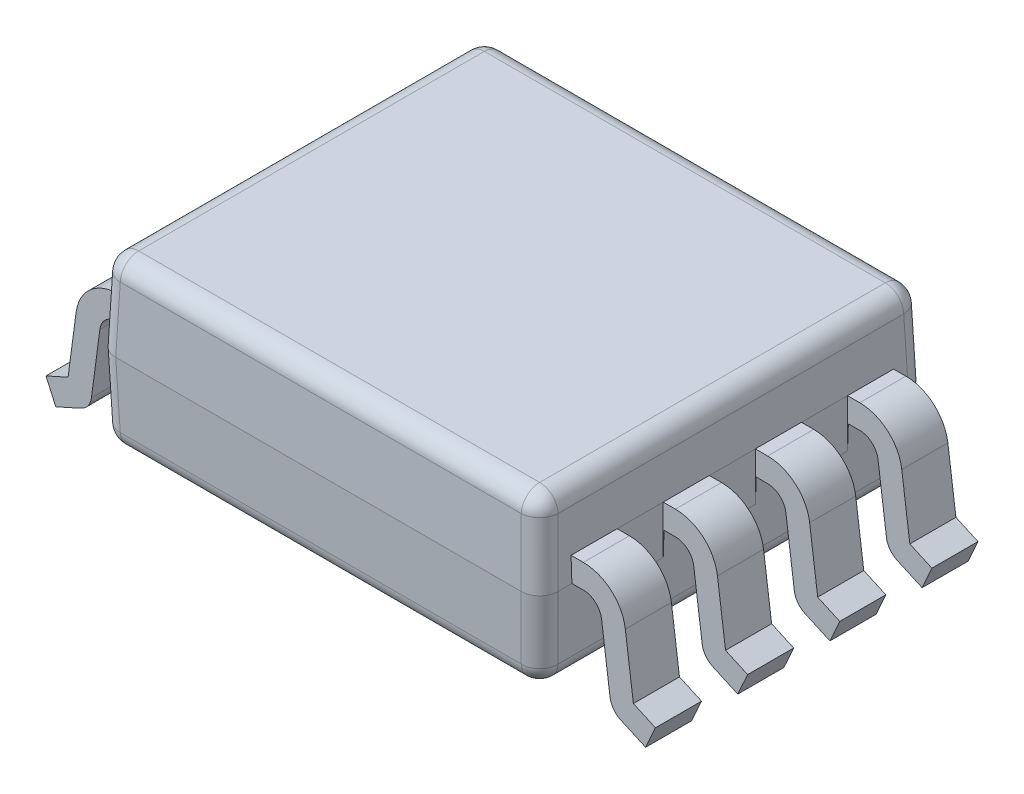
from build123d import *

# Parameters (mm, degrees)
SKETCH_1_W                = 2.4
SKETCH_1_H                = 2.1
EXTRUDE_1_DEPTH           = 0.45
EXTRUDE_1_TAPER           = 2
EXTRUDE_1_OTHER_WAY_DEPTH = 0.45
EXTRUDE_1_OTHER_WAY_TAPER = 2
EXTRUDE_2_DEPTH           = 0.875
EXTRUDE_2_DEPTH_BACK      = 0.875
CUT_EXTRUDE_START         = 0.45
SKETCH_3_W                = 0.457928566
SKETCH_3_H                = 0.25
CUT_EXTRUDE_1_DEPTH       = 3.48987621
FILLET_1_R                = 0.1


with BuildPart() as part:
    # Эскиз1 → Бобышка-Вытянуть1 (new body)
    with BuildSketch(Plane(origin=(0, 0, 0), x_dir=(1, 0, 0), z_dir=(0, 1, 0))):
        Rectangle(SKETCH_1_W, SKETCH_1_H)
    extrude(amount=EXTRUDE_1_DEPTH, taper=EXTRUDE_1_TAPER)

    # Эскиз1 → Бобышка-Вытянуть1 other way (add)
    with BuildSketch(Plane(origin=(0, 0, 0), x_dir=(1, 0, 0), z_dir=(0, 1, 0))):
        Rectangle(SKETCH_1_W, SKETCH_1_H)
    extrude(amount=-EXTRUDE_1_OTHER_WAY_DEPTH, taper=EXTRUDE_1_OTHER_WAY_TAPER)

    # Эскиз2 → Бобышка-Вытянуть2 (add, two sides: drawn at the far end of the back side and taken through both)
    with BuildSketch(Plane.XY.offset(-EXTRUDE_2_DEPTH_BACK)):
        with BuildLine():
            Line((-1.6, -0.57), (-1.464962683, -0.509176407))
            ThreePointArc((-1.464962683, -0.509176407), (-1.425823526, -0.477720926), (-1.406907258, -0.431207534))
            Line((-1.406907258, -0.431207534), (-1.361011417, -0.08679108))
            ThreePointArc((-1.361011417, -0.08679108), (-1.327762925, -0.024764064), (-1.261887634, 0))
            Line((-1.261887634, 0), (-1.2, 0))
            Line((-1.2, 0), (-1.1954603, 0.13))
            Line((-1.1954603, 0.13), (-1.2, 0.13))
            Line((-1.2, 0.13), (-1.261887634, 0.13))
            ThreePointArc((-1.261887634, 0.13), (-1.413400804, 0.073042652), (-1.489872335, -0.069619484))
            Line((-1.489872335, -0.069619484), (-1.533564305, -0.397497415))
            Line((-1.533564305, -0.397497415), (-1.653388866, -0.451468869))
            Line((-1.653388866, -0.451468869), (-1.6, -0.57))
        make_face()
        with BuildLine():
            Line((1.1954603, 0.13), (1.2, 0))
            Line((1.2, 0), (1.261887634, 0))
            ThreePointArc((1.261887634, 0), (1.327762925, -0.024764064), (1.361011417, -0.08679108))
            Line((1.361011417, -0.08679108), (1.406907258, -0.431207534))
            ThreePointArc((1.406907258, -0.431207534), (1.425823526, -0.477720926), (1.464962683, -0.509176407))
            Line((1.464962683, -0.509176407), (1.6, -0.57))
            Line((1.6, -0.57), (1.653388866, -0.451468869))
            Line((1.653388866, -0.451468869), (1.533564305, -0.397497415))
            Line((1.533564305, -0.397497415), (1.489872335, -0.069619484))
            ThreePointArc((1.489872335, -0.069619484), (1.413400804, 0.073042652), (1.261887634, 0.13))
            Line((1.261887634, 0.13), (1.2, 0.13))
            Line((1.2, 0.13), (1.1954603, 0.13))
        make_face()
    extrude(amount=EXTRUDE_2_DEPTH + EXTRUDE_2_DEPTH_BACK)

    # Эскиз3 → Вырез-Вытянуть1 (cut, through all)
    with BuildSketch(Plane(origin=(0, 0, 0), x_dir=(1, 0, 0), z_dir=(0, 1, 0)).offset(CUT_EXTRUDE_START)):
        with Locations((-1.424424583, 0.5)):
            Rectangle(SKETCH_3_W, SKETCH_3_H)
        with Locations((-1.424424583, 0)):
            Rectangle(SKETCH_3_W, SKETCH_3_H)
        with Locations((-1.424424583, -0.5)):
            Rectangle(SKETCH_3_W, SKETCH_3_H)
        with Locations((1.424424583, 0.5)):
            Rectangle(SKETCH_3_W, SKETCH_3_H)
        with Locations((1.424424583, 0)):
            Rectangle(SKETCH_3_W, SKETCH_3_H)
        with Locations((1.424424583, -0.5)):
            Rectangle(SKETCH_3_W, SKETCH_3_H)
    extrude(amount=-CUT_EXTRUDE_1_DEPTH, mode=Mode.SUBTRACT)

    # Скругление1
    fillet_1_edges = [part.edges().sort_by_distance(p)[0] for p in [
        (1.184285654, -0.45, 0),
        (0, -0.45, -1.034285654),
        (-1.192142827, 0.225, -1.042142827),
        (-1.192142827, 0.225, 1.042142827),
        (1.192142827, 0.225, 1.042142827),
        (1.192142827, 0.225, -1.042142827),
        (-1.184285654, 0.45, 0),
        (0, 0.45, 1.034285654),
        (1.184285654, 0.45, 0),
        (0, 0.45, -1.034285654),
        (-1.184285654, -0.45, 0),
        (0, -0.45, 1.034285654),
        (-1.192142827, -0.225, -1.042142827),
        (1.192142827, -0.225, -1.042142827),
        (1.192142827, -0.225, 1.042142827),
        (-1.192142827, -0.225, 1.042142827),
    ]]
    fillet(fillet_1_edges, radius=FILLET_1_R)


solid = part.part
